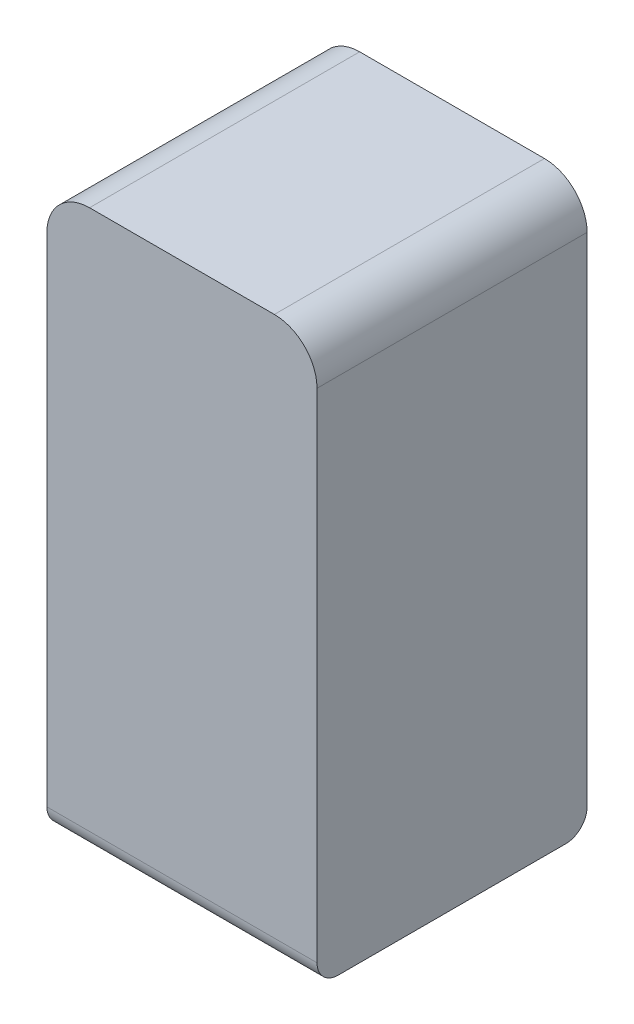
from build123d import *

# Parameters (mm, degrees)
SKETCH1_W           = 38
SKETCH1_H           = 79
BOSS_EXTRUDE1_DEPTH = 38
FILLET1_R           = 6
FILLET2_R           = 3


with BuildPart() as part:
    # Sketch1 → Boss-Extrude1 (new body)
    with BuildSketch(Plane.XY):
        Rectangle(SKETCH1_W, SKETCH1_H)
    extrude(amount=BOSS_EXTRUDE1_DEPTH)

    # Fillet1
    fillet1_edges = [part.edges().sort_by_distance(p)[0] for p in [
        (-19, 39.5, 19),
        (19, 39.5, 19),
    ]]
    fillet(fillet1_edges, radius=FILLET1_R)

    # Fillet2
    fillet2_edges = [part.edges().sort_by_distance(p)[0] for p in [
        (0, -39.5, 38),
        (0, -39.5, 0),
    ]]
    fillet(fillet2_edges, radius=FILLET2_R)


solid = part.part
